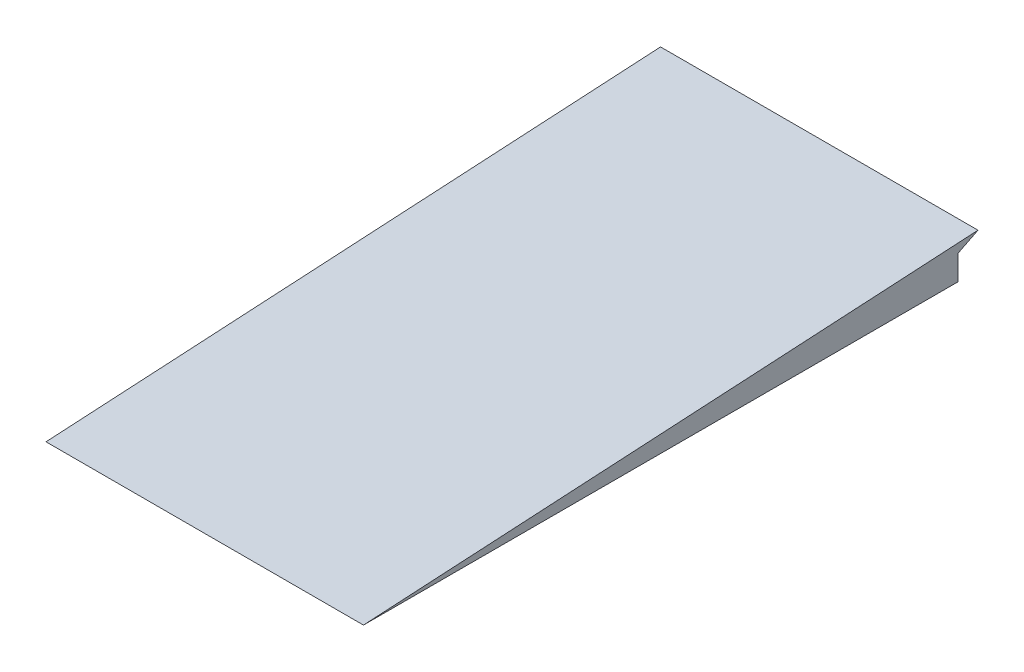
from build123d import *

# Parameters (mm, degrees)
BOSS_EXTRUDE1_DEPTH = 812.8
BOSS_EXTRUDE2_DEPTH = 1625.6


with BuildPart() as part:
    # Sketch1 → Boss-Extrude1 (new, symmetric)
    with BuildSketch(Plane(origin=(0, 0, 0), x_dir=(0, 0, -1), z_dir=(1, 0, 0))):
        Polygon((0, 0), (3045.353017304, 127), (3045.353017304, 0), align=None)
    extrude(amount=BOSS_EXTRUDE1_DEPTH, both=True)

    # Sketch2 → Boss-Extrude2 (add)
    with BuildSketch(Plane(origin=(812.8, 0, 0), x_dir=(0, 0, -1), z_dir=(1, 0, 0))):
        Polygon((3045.353017304, 127), (3146.953017304, 177.8), (0, 0), align=None)
    extrude(amount=-BOSS_EXTRUDE2_DEPTH)


solid = part.part
